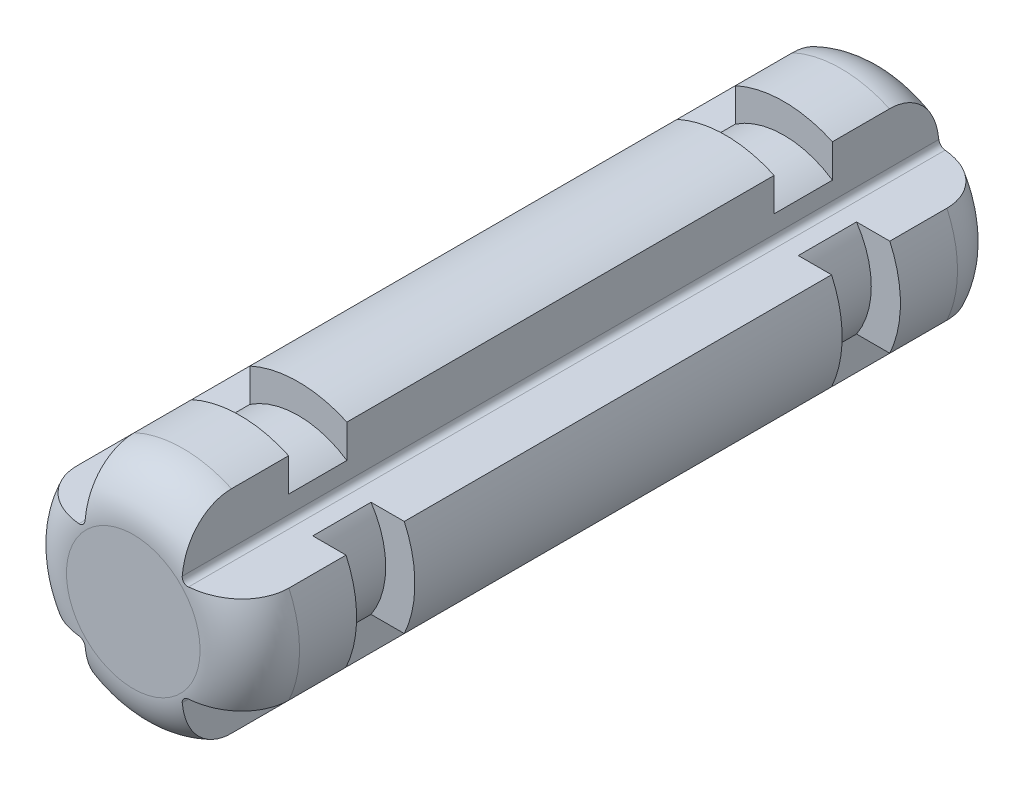
from build123d import *

# Parameters (mm, degrees)
SKETCH1_R           = 2.38125
EXTRUDE1_DEPTH      = 7.7390625
FILLET1_R           = 1.016
EXTRUDE2_DEPTH      = 9.440011345
EXTRUDE2_DEPTH_BACK = 9.440011345
SKETCH4_W           = 0.5953125
SKETCH4_H           = 1.190625


with BuildPart() as part:
    # Sketch1 → Extrude1 (new, symmetric)
    with BuildSketch(Plane.XY):
        Circle(SKETCH1_R)
    extrude(amount=EXTRUDE1_DEPTH, both=True)

    # Fillet1
    fillet1_edges = [part.edges().sort_by_distance(p)[0] for p in [
        (-2.38125, 0, -7.7390625),
        (-2.38125, 0, 7.7390625),
    ]]
    fillet(fillet1_edges, radius=FILLET1_R)

    # Sketch3 → Extrude2 (cut, two sides: drawn at the far end of the back side and taken through both)
    with BuildSketch(Plane.XY.offset(-EXTRUDE2_DEPTH_BACK)):
        with BuildLine():
            Line((-0.9921875, 2.16469756), (-0.9921875, 1.1191875))
            ThreePointArc((-0.9921875, 1.1191875), (-1.029384939, 1.029384939), (-1.1191875, 0.9921875))
            Line((-1.1191875, 0.9921875), (-2.16469756, 0.9921875))
            ThreePointArc((-2.16469756, 0.9921875), (-1.683798023, 1.683798023), (-0.9921875, 2.16469756))
        make_face()
        with BuildLine():
            Line((-2.16469756, -0.9921875), (-1.1191875, -0.9921875))
            ThreePointArc((-1.1191875, -0.9921875), (-1.029384939, -1.029384939), (-0.9921875, -1.1191875))
            Line((-0.9921875, -1.1191875), (-0.9921875, -2.16469756))
            ThreePointArc((-0.9921875, -2.16469756), (-1.683798023, -1.683798023), (-2.16469756, -0.9921875))
        make_face()
        with BuildLine():
            Line((0.9921875, 2.16469756), (0.9921875, 1.1191875))
            ThreePointArc((0.9921875, 1.1191875), (1.029384939, 1.029384939), (1.1191875, 0.9921875))
            Line((1.1191875, 0.9921875), (2.16469756, 0.9921875))
            ThreePointArc((2.16469756, 0.9921875), (1.683798023, 1.683798023), (0.9921875, 2.16469756))
        make_face()
        with BuildLine():
            Line((0.9921875, -1.1191875), (0.9921875, -2.16469756))
            ThreePointArc((0.9921875, -2.16469756), (1.683798023, -1.683798023), (2.16469756, -0.9921875))
            Line((2.16469756, -0.9921875), (1.1191875, -0.9921875))
            ThreePointArc((1.1191875, -0.9921875), (1.029384939, -1.029384939), (0.9921875, -1.1191875))
        make_face()
    extrude(amount=EXTRUDE2_DEPTH + EXTRUDE2_DEPTH_BACK, mode=Mode.SUBTRACT)

    # Sketch4 → Cut-Revolve1 (revolve, cut)
    with BuildSketch(Plane(origin=(0, 0, 0), x_dir=(1, 0, 0), z_dir=(0, 1, 0))):
        with Locations((-2.08359375, 4.9609375)):
            Rectangle(SKETCH4_W, SKETCH4_H)
        with Locations((-2.08359375, -4.9609375)):
            Rectangle(SKETCH4_W, SKETCH4_H)
    revolve(axis=Axis((0, 0, -7.7390625), (0, 0, 1)), mode=Mode.SUBTRACT)


solid = part.part
